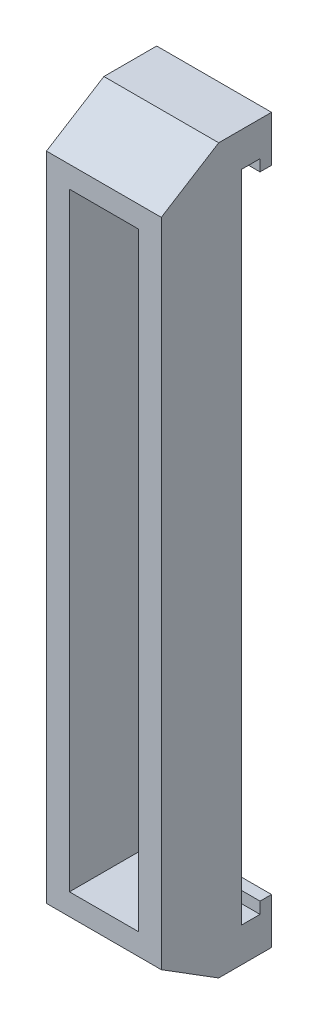
from build123d import *
from OCP.BRepFilletAPI import BRepFilletAPI_MakeChamfer

# Parameters (mm, degrees)
SZKIC3_W                    = 10
SZKIC3_H                    = 63
DODANIE_WYCI_GNI_CIE1_DEPTH = 7
WYTNIJ_WYCI_GNI_CIE1_REACH  = 66.172
SZKIC4_W                    = 6
SZKIC4_H                    = 53
SFAZOWANIE1_SIZE            = 5
SFAZOWANIE1_SIZE2           = 3.12434676
DODANIE_WYCI_GNI_CIE2_DEPTH = 10


with BuildPart() as part:
    # Szkic3 → Dodanie-wyciągnięcie1 (new body)
    with BuildSketch(Plane.XY):
        with Locations((5, 31.5)):
            Rectangle(SZKIC3_W, SZKIC3_H)
    extrude(amount=DODANIE_WYCI_GNI_CIE1_DEPTH)

    # Szkic4 → Wytnij-wyciągnięcie1 (cut, up to next)
    with BuildSketch(Plane.XY.offset(7), mode=Mode.PRIVATE) as wytnij_wyci_gni_cie1_sk1:
        with Locations((5, 31.5)):
            Rectangle(SZKIC4_W, SZKIC4_H)
    wytnij_wyci_gni_cie1_tool1 = extrude(wytnij_wyci_gni_cie1_sk1.sketch, amount=-WYTNIJ_WYCI_GNI_CIE1_REACH, mode=Mode.PRIVATE) & part.part
    add(wytnij_wyci_gni_cie1_tool1.solids().sort_by_distance((5, 31.5, 7))[0], mode=Mode.SUBTRACT)

    # Sfazowanie1: one chamfer whose edges measure the first distance from different faces: ONE call of the kernel's chamfer builder (chamfer() names one face for all edges)
    sfazowanie1_edges_1 = [part.edges().sort_by_distance(p)[0] for p in [
        (5, 63, 7),
    ]]
    sfazowanie1_side_1 = [part.faces().sort_by_distance(p)[0] for p in [
        (5, 63, 3.5),
    ]]
    sfazowanie1_edges_2 = [part.edges().sort_by_distance(p)[0] for p in [
        (5, 0, 7),
    ]]
    sfazowanie1_side_2 = [part.faces().sort_by_distance(p)[0] for p in [
        (5, 0, 3.5),
    ]]
    sfazowanie1 = BRepFilletAPI_MakeChamfer(part.part.solid().wrapped)
    for e in sfazowanie1_edges_1:
        sfazowanie1.Add(SFAZOWANIE1_SIZE, SFAZOWANIE1_SIZE2, e.wrapped, sfazowanie1_side_1[0].wrapped)  # the first distance lies on this face
    for e in sfazowanie1_edges_2:
        sfazowanie1.Add(SFAZOWANIE1_SIZE, SFAZOWANIE1_SIZE2, e.wrapped, sfazowanie1_side_2[0].wrapped)  # the first distance lies on this face
    add(Compound.cast(sfazowanie1.Shape()), mode=Mode.REPLACE)

    # Szkic6 → Dodanie-wyciągnięcie2 (add)
    with BuildSketch(Plane.ZY):
        Polygon((0, 63), (-2.6, 63), (-2.6, 59), (-1.6, 59), (-1.6, 60), (0, 60), align=None)
        Polygon((0, 0), (-2.6, 0), (-2.6, 4), (-1.6, 4), (-1.6, 3), (0, 3), align=None)
    extrude(amount=-DODANIE_WYCI_GNI_CIE2_DEPTH)


solid = part.part
